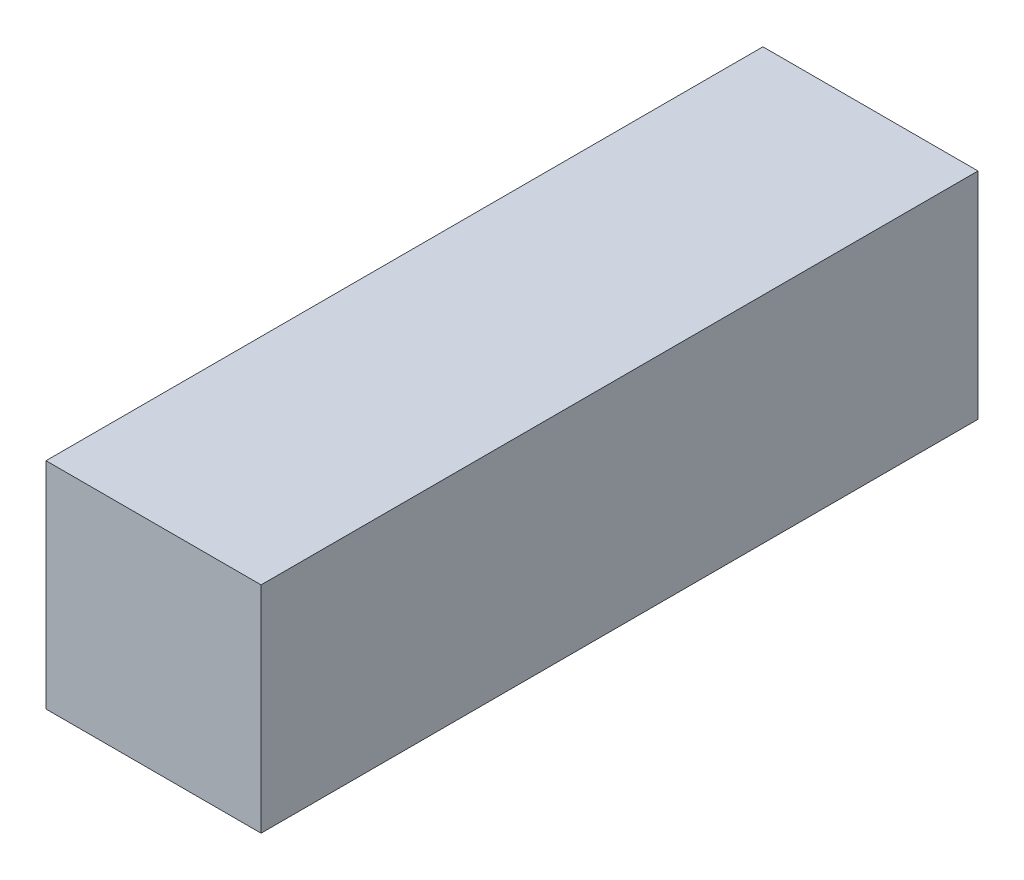
from build123d import *

# Parameters (mm, degrees)
SKETCH2_W           = 3
SKETCH2_H           = 3
BOSS_EXTRUDE1_DEPTH = 10


with BuildPart() as part:
    # Sketch2 → Boss-Extrude1 (new body)
    with BuildSketch(Plane.XY):
        Rectangle(SKETCH2_W, SKETCH2_H)
    extrude(amount=BOSS_EXTRUDE1_DEPTH)


solid = part.part
